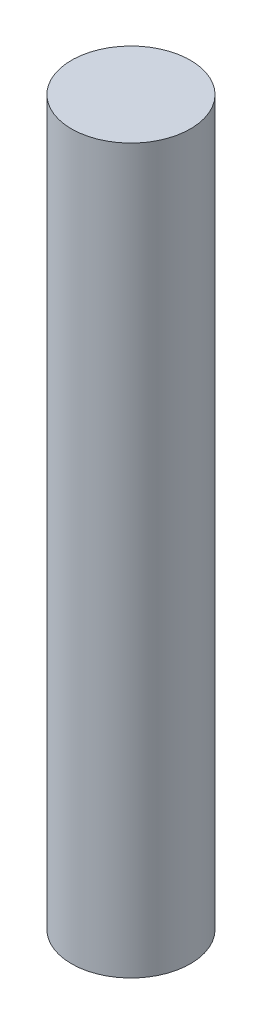
from build123d import *

# Parameters (mm, degrees)
SKETCH1_R           = 2.925
BOSS_EXTRUDE1_DEPTH = 35.56


with BuildPart() as part:
    # Sketch1 → Boss-Extrude1 (new body)
    with BuildSketch(Plane(origin=(0, 0, 0), x_dir=(1, 0, 0), z_dir=(0, 1, 0))):
        with Locations(Location((0, 0, 0), (0, 0, 270))):
            Circle(SKETCH1_R)
    extrude(amount=BOSS_EXTRUDE1_DEPTH)


solid = part.part
